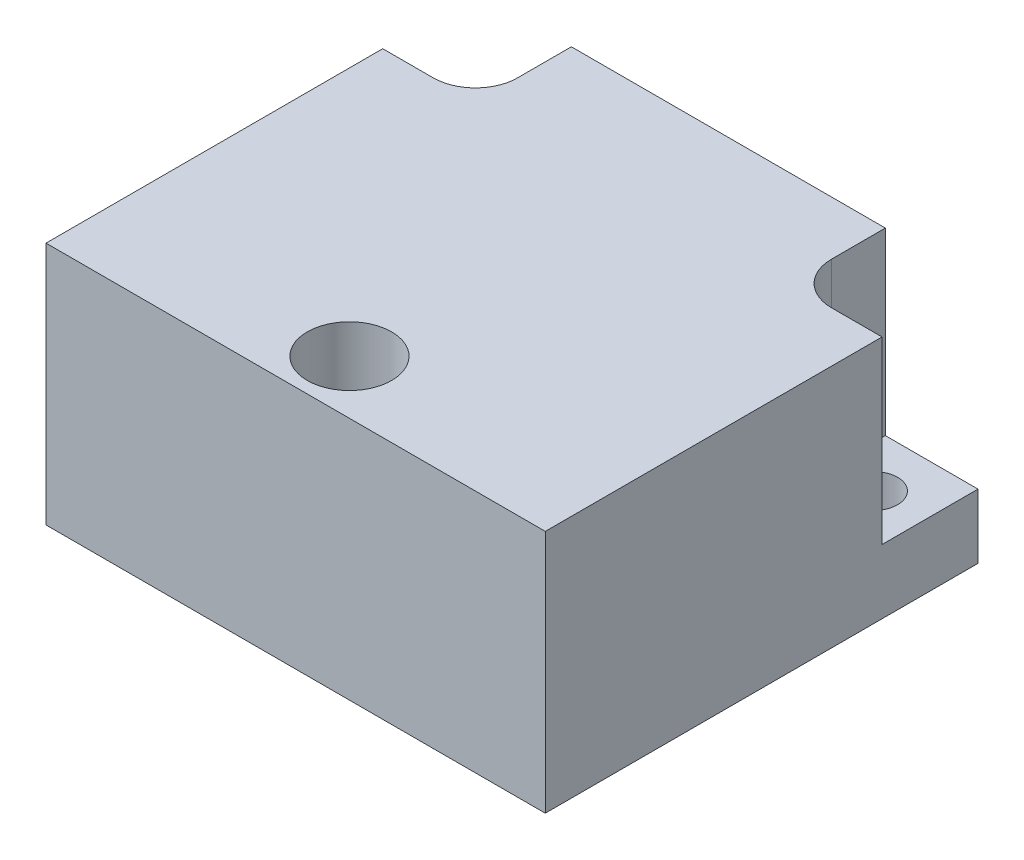
from build123d import *

# Parameters (mm, degrees)
SKETCH1_W            = 45
SKETCH1_H            = 39
BOSS_EXTRUDE1_DEPTH  = 22
M4_CLEARANCE_HOLE1_D = 4.3
SKETCH5_R            = 3.8
CUT_EXTRUDE1_DEPTH   = 16.2


with BuildPart() as part:
    # Sketch1 → Boss-Extrude1 (new body)
    with BuildSketch(Plane(origin=(0, 0, 0), x_dir=(1, 0, 0), z_dir=(0, 1, 0))):
        Rectangle(SKETCH1_W, SKETCH1_H)
    extrude(amount=BOSS_EXTRUDE1_DEPTH)

    # M4 Clearance Hole1 (through all)
    with Locations(Plane(origin=(0, 0, 0), x_dir=(-1, 0, 0), z_dir=(0, -1, 0))):
        with Locations((0, -14.65), (-17.95, 14.65), (17.95, 14.65)):
            Hole(M4_CLEARANCE_HOLE1_D / 2)

    # Sketch5 → Cut-Extrude1 (cut)
    with BuildSketch(Plane(origin=(0, 22, 0), x_dir=(1, 0, 0), z_dir=(0, 1, 0))):
        with Locations(Location((0, -14.65, 0), (0, 0, 270))):
            Circle(SKETCH5_R)
        with BuildLine():
            Line((-14.15, 14.65), (-14.15, 22.25))
            Line((-14.15, 22.25), (-25.55, 22.25))
            Line((-25.55, 22.25), (-25.55, 10.85))
            Line((-25.55, 10.85), (-17.95, 10.85))
            ThreePointArc((-17.95, 10.85), (-15.262994231, 11.962994231), (-14.15, 14.65))
        make_face()
        with BuildLine():
            Line((17.95, 10.85), (25.55, 10.85))
            Line((25.55, 10.85), (25.55, 22.25))
            Line((25.55, 22.25), (14.15, 22.25))
            Line((14.15, 22.25), (14.15, 14.65))
            ThreePointArc((14.15, 14.65), (15.262994231, 11.962994231), (17.95, 10.85))
        make_face()
    extrude(amount=-CUT_EXTRUDE1_DEPTH, mode=Mode.SUBTRACT)


solid = part.part
